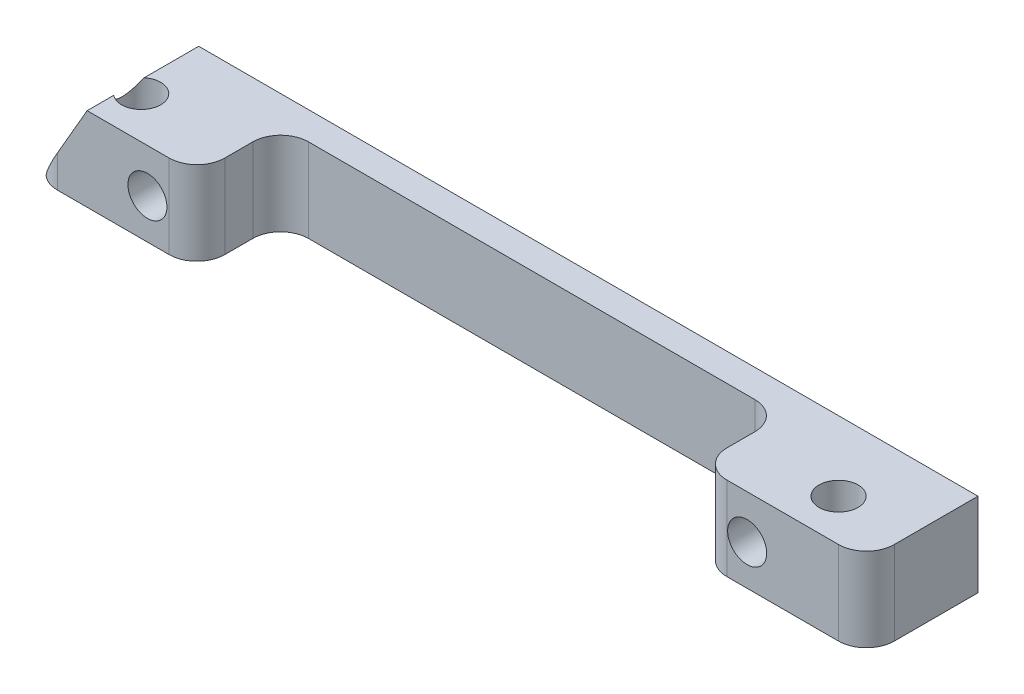
from build123d import *

# Parameters (mm, degrees)
SKETCH1_W           = 60
SKETCH1_H           = 6
BASE_DEPTH          = 2
BOSS_EXTRUDE2_DEPTH = 6
FILLET1_R           = 2
CROP_REACH          = 33.193
FAN_SCREWS_REACH    = 33.623
SKETCH5_R           = 1.4
PCB_SCREWS_REACH    = 33.193
SKETCH3_R           = 1.4


with BuildPart() as part:
    # Sketch1 → Base (new body)
    with BuildSketch(Plane.XY):
        Rectangle(SKETCH1_W, SKETCH1_H)
    extrude(amount=BASE_DEPTH)

    # Sketch4 → Boss-Extrude2 (add)
    with BuildSketch(Plane(origin=(0, -3, 0), x_dir=(1, 0, 0), z_dir=(0, 1, 0))):
        Polygon((-30, -2), (-18, -2), (-18, -8), (-25, -8), (-30, -8), align=None)
        Polygon((30, -2), (30, -8), (25, -8), (18, -8), (18, -2), align=None)
    extrude(amount=BOSS_EXTRUDE2_DEPTH)

    # Fillet1
    fillet1_edges = [part.edges().sort_by_distance(p)[0] for p in [
        (-18, 0, 2),
        (-18, 0, 8),
        (-30, 0, 8),
        (30, 0, 8),
        (18, 0, 8),
        (18, 0, 2),
    ]]
    fillet(fillet1_edges, radius=FILLET1_R)

    # Sketch2 → Crop (cut, up to next)
    with BuildSketch(Plane.XY, mode=Mode.PRIVATE) as crop_sk1:
        Polygon((-25.875432474, 3), (-29.339534089, -3), (-30, -3), (-30, 3), align=None)
    crop_tool1 = extrude(crop_sk1.sketch, amount=CROP_REACH, mode=Mode.PRIVATE) & part.part
    add(crop_tool1.solids().sort_by_distance((-28.594757, 0.723945, 0))[0], mode=Mode.SUBTRACT)

    # Sketch5 → Fan screws (cut, up to next)
    with BuildSketch(Plane.XZ.offset(3), mode=Mode.PRIVATE) as fan_screws_sk1:
        with Locations(Location((25, 5, 0), (0, 0, 270))):
            Circle(SKETCH5_R)
    fan_screws_tool1 = extrude(fan_screws_sk1.sketch, amount=-FAN_SCREWS_REACH, mode=Mode.PRIVATE) & part.part
    # Sketch5 → Fan screws (cut, up to next)
    with BuildSketch(Plane.XZ.offset(3), mode=Mode.PRIVATE) as fan_screws_sk2:
        with Locations(Location((-25, 5, 0), (0, 0, 270))):
            Circle(SKETCH5_R)
    fan_screws_tool2 = extrude(fan_screws_sk2.sketch, amount=-FAN_SCREWS_REACH, mode=Mode.PRIVATE) & part.part
    add(fan_screws_tool1.solids().sort_by_distance((25, -3, 5))[0], mode=Mode.SUBTRACT)
    add(fan_screws_tool2.solids().sort_by_distance((-25, -3, 5))[0], mode=Mode.SUBTRACT)

    # Sketch3 → PCB screws (cut, up to next)
    with BuildSketch(Plane.XY, mode=Mode.PRIVATE) as pcb_screws_sk1:
        with Locations(Location((21.448, -0.1262, 0), (0, 0, 180))):
            Circle(SKETCH3_R)
    pcb_screws_tool1 = extrude(pcb_screws_sk1.sketch, amount=PCB_SCREWS_REACH, mode=Mode.PRIVATE) & part.part
    # Sketch3 → PCB screws (cut, up to next)
    with BuildSketch(Plane.XY, mode=Mode.PRIVATE) as pcb_screws_sk2:
        with Locations(Location((-21.552, -0.1262, 0), (0, 0, 180))):
            Circle(SKETCH3_R)
    pcb_screws_tool2 = extrude(pcb_screws_sk2.sketch, amount=PCB_SCREWS_REACH, mode=Mode.PRIVATE) & part.part
    add(pcb_screws_tool1.solids().sort_by_distance((21.448, -0.1262, 0))[0], mode=Mode.SUBTRACT)
    add(pcb_screws_tool2.solids().sort_by_distance((-21.552, -0.1262, 0))[0], mode=Mode.SUBTRACT)


solid = part.part
